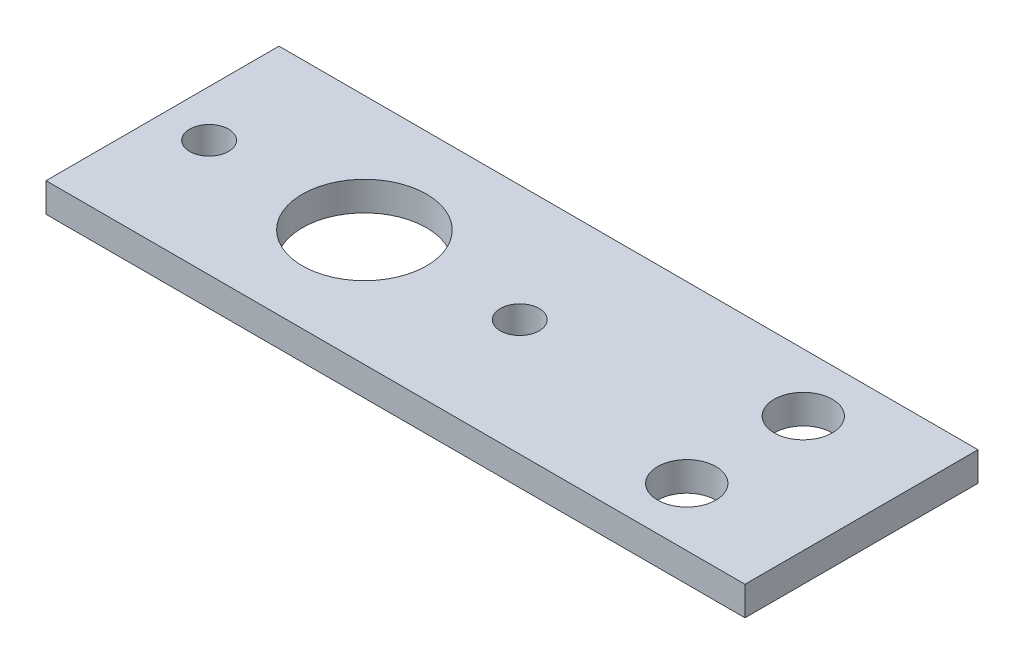
from build123d import *

# Parameters (mm, degrees)
SKETCH3_W           = 114.3
SKETCH3_H           = 38.1
SKETCH3_R           = 3.175
SKETCH3_R_2         = 10.16
SKETCH3_R_3         = 4.7625
BOSS_EXTRUDE1_DEPTH = 4.7625


with BuildPart() as part:
    # Sketch3 → Boss-Extrude1 (new body)
    with BuildSketch(Plane(origin=(0, 0, 0), x_dir=(1, 0, 0), z_dir=(0, 1, 0))):
        with Locations((-57.15, 0)):
            Rectangle(SKETCH3_W, SKETCH3_H)
        with Locations(Location((-106.68, 0, 0), (0, 0, 90))):
            Circle(SKETCH3_R, mode=Mode.SUBTRACT)
        with Locations(Location((-81.28, 0, 0), (0, 0, 90))):
            Circle(SKETCH3_R_2, mode=Mode.SUBTRACT)
        with Locations(Location((-55.88, 0, 0), (0, 0, 90))):
            Circle(SKETCH3_R, mode=Mode.SUBTRACT)
        with Locations(Location((-19.05, 9.525, 0), (0, 0, 90))):
            Circle(SKETCH3_R_3, mode=Mode.SUBTRACT)
        with Locations(Location((-19.05, -9.525, 0), (0, 0, 90))):
            Circle(SKETCH3_R_3, mode=Mode.SUBTRACT)
    extrude(amount=BOSS_EXTRUDE1_DEPTH)


solid = part.part
